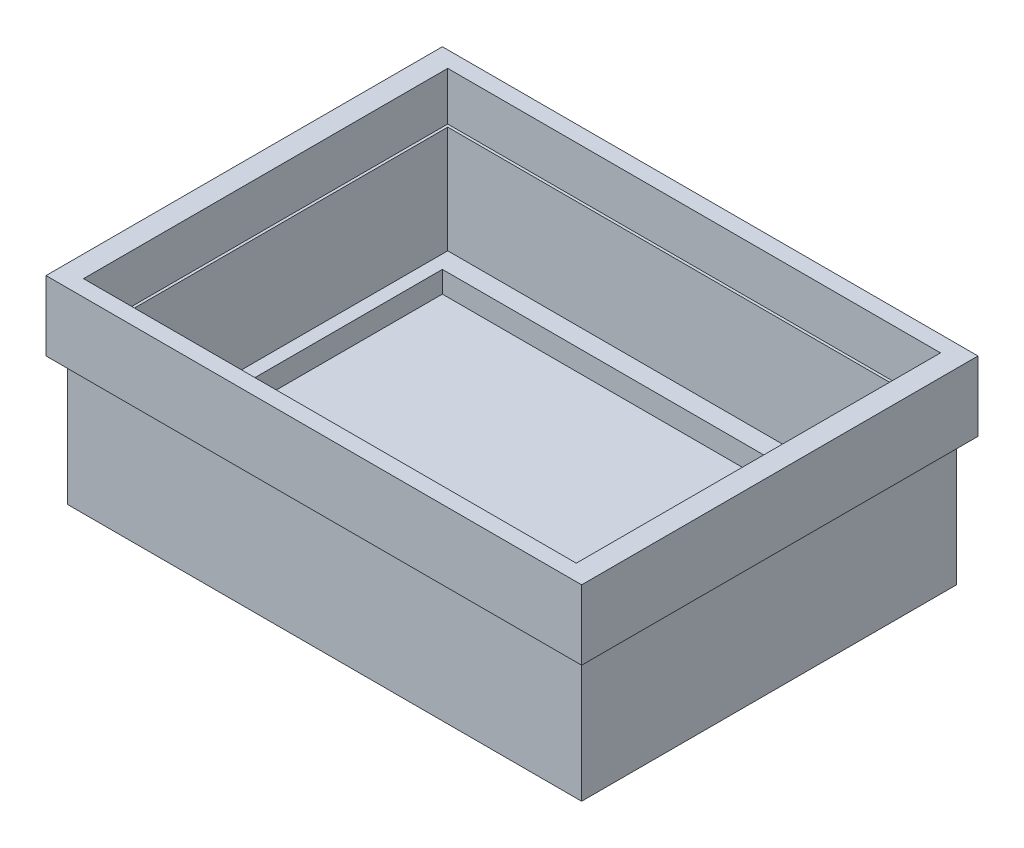
from build123d import *

# Parameters (mm, degrees)
SKETCH2_W           = 500
SKETCH2_H           = 370
SKETCH2_W_2         = 430
SKETCH2_H_2         = 300
BOSS_EXTRUDE1_DEPTH = 120
SKETCH4_W           = 500
SKETCH4_H           = 370
SKETCH4_W_2         = 460
SKETCH4_H_2         = 340
BOSS_EXTRUDE2_DEPTH = 45
SKETCH5_W           = 500
SKETCH5_H           = 370
BOSS_EXTRUDE3_DEPTH = 20
SKETCH6_W           = 500
SKETCH6_H           = 370
SKETCH6_W_2         = 480
SKETCH6_H_2         = 350
CUT_EXTRUDE1_DEPTH  = 120
SKETCH8_W           = 455
SKETCH8_H           = 335
CUT_EXTRUDE2_DEPTH  = 100


with BuildPart() as part:
    # Sketch2 → Boss-Extrude1 (new body)
    with BuildSketch(Plane(origin=(0, 0, 0), x_dir=(1, 0, 0), z_dir=(0, 1, 0))):
        Rectangle(SKETCH2_W, SKETCH2_H)
        Rectangle(SKETCH2_W_2, SKETCH2_H_2, mode=Mode.SUBTRACT)
    extrude(amount=BOSS_EXTRUDE1_DEPTH)

    # Sketch4 → Boss-Extrude2 (add)
    with BuildSketch(Plane(origin=(0, 120, 0), x_dir=(1, 0, 0), z_dir=(0, 1, 0))):
        Rectangle(SKETCH4_W, SKETCH4_H)
        Rectangle(SKETCH4_W_2, SKETCH4_H_2, mode=Mode.SUBTRACT)
    extrude(amount=BOSS_EXTRUDE2_DEPTH)

    # Sketch5 → Boss-Extrude3 (add)
    with BuildSketch(Plane.XZ):
        Rectangle(SKETCH5_W, SKETCH5_H)
    extrude(amount=BOSS_EXTRUDE3_DEPTH)

    # Sketch6 → Cut-Extrude1 (cut)
    with BuildSketch(Plane.XZ.offset(20)):
        Rectangle(SKETCH6_W, SKETCH6_H)
        Rectangle(SKETCH6_W_2, SKETCH6_H_2, mode=Mode.SUBTRACT)
    extrude(amount=-CUT_EXTRUDE1_DEPTH, mode=Mode.SUBTRACT)

    # Sketch8 → Cut-Extrude2 (cut)
    with BuildSketch(Plane(origin=(0, 120, 0), x_dir=(1, 0, 0), z_dir=(0, 1, 0))):
        Rectangle(SKETCH8_W, SKETCH8_H)
    extrude(amount=-CUT_EXTRUDE2_DEPTH, mode=Mode.SUBTRACT)


solid = part.part
